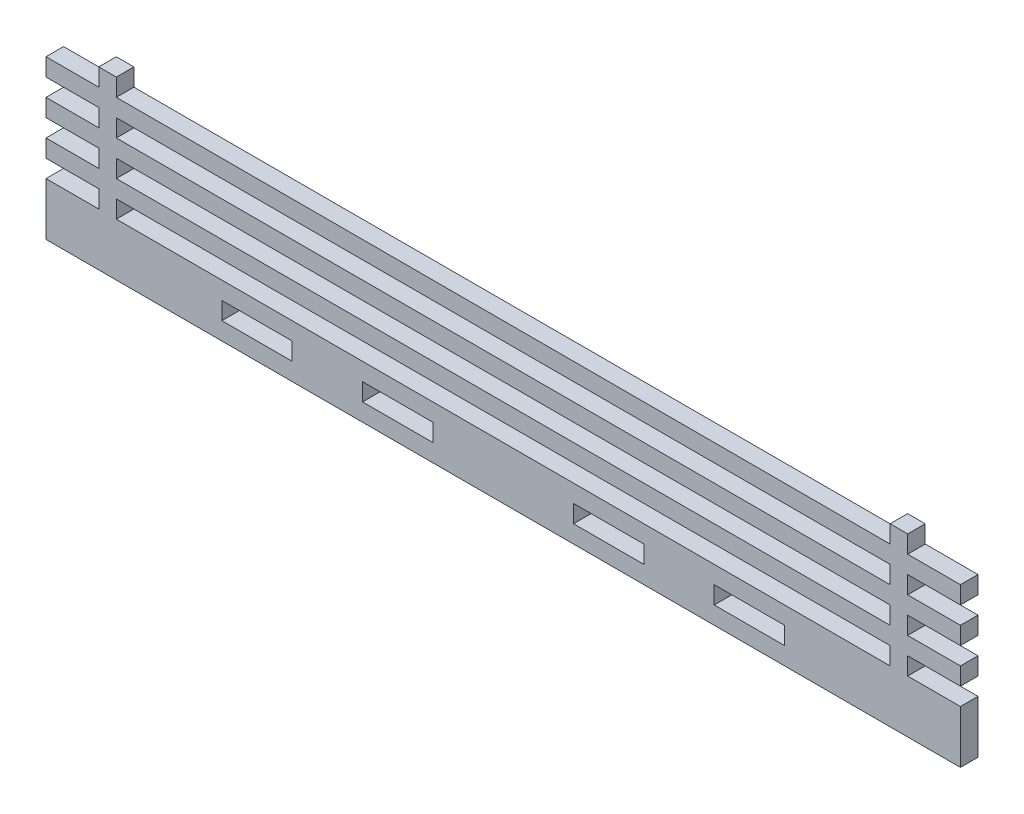
from build123d import *

# Parameters (mm, degrees)
SKETCH1_W           = 110
SKETCH1_H           = 2.5
SKETCH1_W_2         = 10
BOSS_EXTRUDE1_DEPTH = 2.5


with BuildPart() as part:
    # Sketch1 → Boss-Extrude1 (new body)
    with BuildSketch(Plane.XY):
        Polygon((-65, -12.5), (65, -12.5), (65, -5), (57.5, -5), (57.5, -2.5), (65, -2.5), (65, 0), (57.5, 0), (57.5, 2.5), (65, 2.5), (65, 5), (57.5, 5), (57.5, 7.5), (65, 7.5), (65, 10), (57.5, 10), (57.5, 12.5), (55, 12.5), (55, 10), (-55, 10), (-55, 12.5), (-57.5, 12.5), (-57.5, 10), (-65, 10), (-65, 7.5), (-57.5, 7.5), (-57.5, 5), (-65, 5), (-65, 2.5), (-57.5, 2.5), (-57.5, 0), (-65, 0), (-65, -2.5), (-57.5, -2.5), (-57.5, -5), (-65, -5), align=None)
        with Locations((0, -3.75)):
            Rectangle(SKETCH1_W, SKETCH1_H, mode=Mode.SUBTRACT)
        with Locations((0, 6.25)):
            Rectangle(SKETCH1_W, SKETCH1_H, mode=Mode.SUBTRACT)
        with Locations((0, 1.25)):
            Rectangle(SKETCH1_W, SKETCH1_H, mode=Mode.SUBTRACT)
        with Locations((-15, -8.75)):
            Rectangle(SKETCH1_W_2, SKETCH1_H, mode=Mode.SUBTRACT)
        with Locations((-35, -8.75)):
            Rectangle(SKETCH1_W_2, SKETCH1_H, mode=Mode.SUBTRACT)
        with Locations((15, -8.75)):
            Rectangle(SKETCH1_W_2, SKETCH1_H, mode=Mode.SUBTRACT)
        with Locations((35, -8.75)):
            Rectangle(SKETCH1_W_2, SKETCH1_H, mode=Mode.SUBTRACT)
    extrude(amount=BOSS_EXTRUDE1_DEPTH)


solid = part.part
